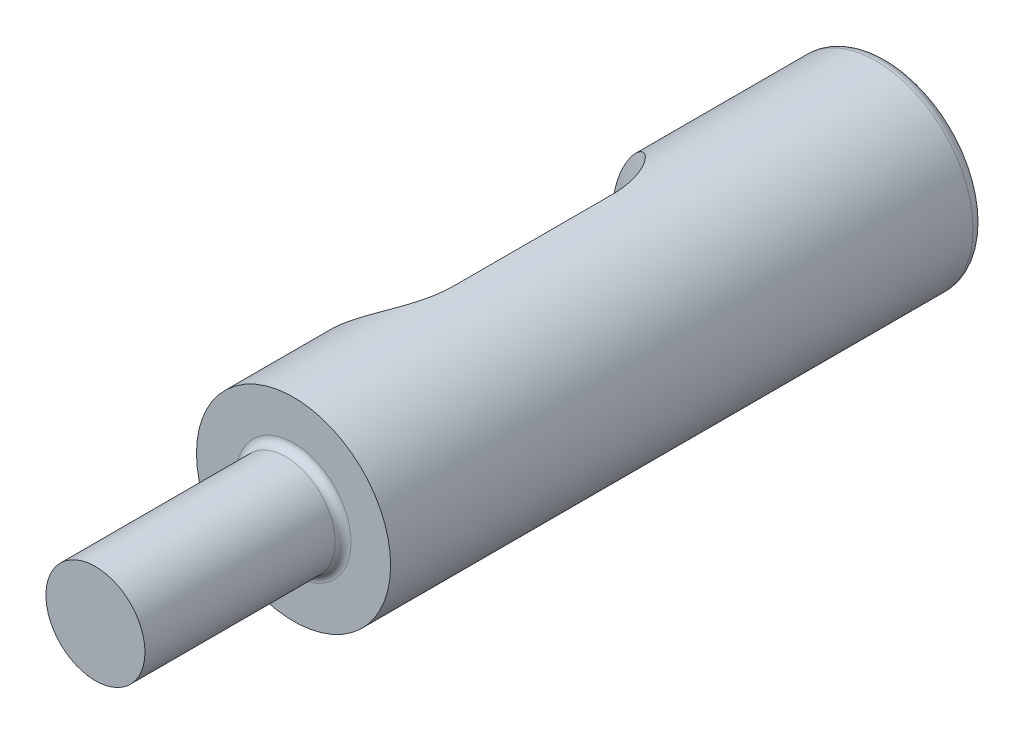
from build123d import *

# Parameters (mm, degrees)
SKETCH_1_R               = 2.45
EXTRUDE_1_DEPTH          = 15
CUT_EXTRUDE_1_DEPTH      = 16.39496671
CUT_EXTRUDE_1_DEPTH_BACK = 16.39496671
SKETCH_3_R               = 1.25
EXTRUDE_2_DEPTH          = 5
FILLET_1_R               = 0.3
FILLET_2_R               = 0.2


with BuildPart() as part:
    # 스케치1 → 보스-돌출1 (new body)
    with BuildSketch(Plane.XY):
        Circle(SKETCH_1_R)
    extrude(amount=EXTRUDE_1_DEPTH)

    # 스케치2 → 컷-돌출1 (cut, two sides: drawn at the far end of the back side and taken through both)
    with BuildSketch(Plane(origin=(0, 0, 0), x_dir=(1, 0, 0), z_dir=(0, 1, 0)).offset(-CUT_EXTRUDE_1_DEPTH_BACK)):
        with BuildLine():
            Line((-4.45, -6.5), (-4.45, -10.5))
            ThreePointArc((-4.45, -10.5), (-2.45, -12.5), (-0.45, -10.5))
            Line((-0.45, -10.5), (-0.45, -6.5))
            ThreePointArc((-0.45, -6.5), (-2.45, -4.5), (-4.45, -6.5))
        make_face()
    extrude(amount=CUT_EXTRUDE_1_DEPTH + CUT_EXTRUDE_1_DEPTH_BACK, mode=Mode.SUBTRACT)

    # 스케치3 → 보스-돌출2 (add)
    with BuildSketch(Plane.XY.offset(15)):
        Circle(SKETCH_3_R)
    extrude(amount=EXTRUDE_2_DEPTH)

    # 필렛1
    fillet_1_edges = [part.edges().sort_by_distance(p)[0] for p in [
        (-2.45, 0, 0),
    ]]
    fillet(fillet_1_edges, radius=FILLET_1_R)

    # 필렛2
    fillet_2_edges = [part.edges().sort_by_distance(p)[0] for p in [
        (-1.25, 0, 15),
    ]]
    fillet(fillet_2_edges, radius=FILLET_2_R)


solid = part.part
